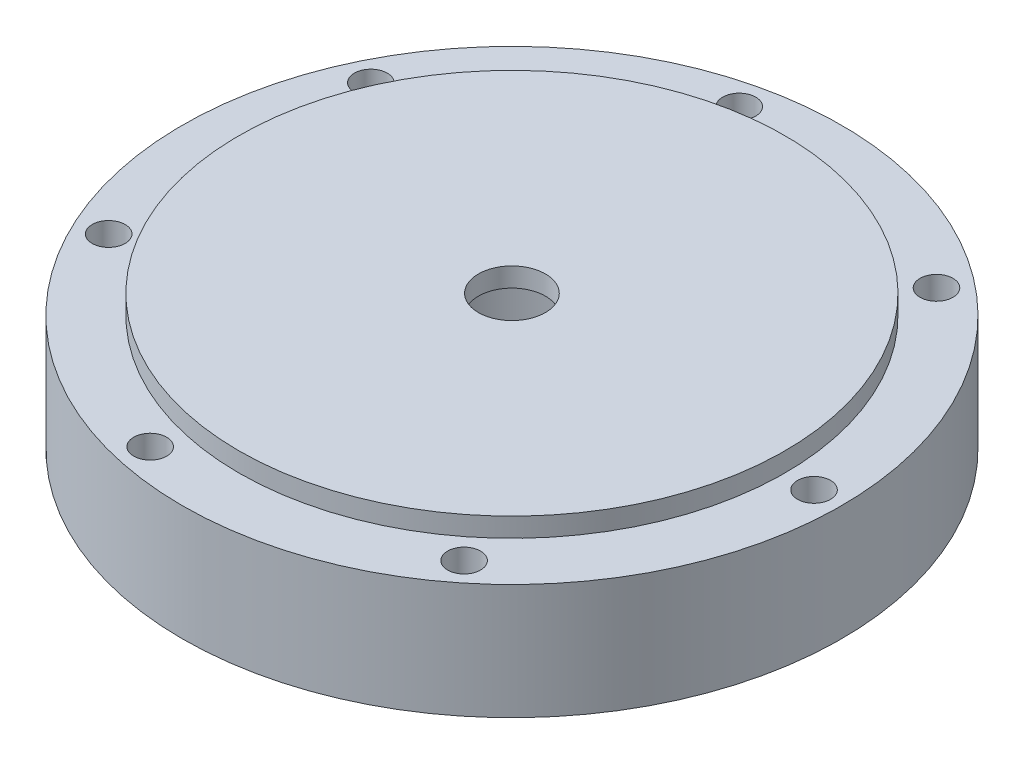
from build123d import *

# Parameters (mm, degrees)
CROQUIS1_R              = 24.85
CROQUIS1_R_2            = 3.05
SALIENTE_EXTRUIR1_DEPTH = 1.75
CROQUIS2_R              = 30
SALIENTE_EXTRUIR2_DEPTH = 10.5
CROQUIS3_R              = 1.5
CORTAR_EXTRUIR1_DEPTH   = 44.706406853


with BuildPart() as part:
    # Croquis1 → Saliente-Extruir1 (new body)
    with BuildSketch(Plane(origin=(0, 0, 0), x_dir=(1, 0, 0), z_dir=(0, 1, 0))):
        with Locations(Location((0, 0, 0), (0, 0, 270))):
            Circle(CROQUIS1_R)
        with Locations(Location((0, 0, 0), (0, 0, 270))):
            Circle(CROQUIS1_R_2, mode=Mode.SUBTRACT)
    extrude(amount=SALIENTE_EXTRUIR1_DEPTH)

    # Croquis2 → Saliente-Extruir2 (add)
    with BuildSketch(Plane(origin=(0, 0, 0), x_dir=(1, 0, 0), z_dir=(0, 1, 0))):
        with Locations(Location((0, 0, 0), (0, 0, 270))):
            Circle(CROQUIS2_R)
        with BuildLine():
            Line((-4.135214626, 9.05), (4.135214626, 9.05))
            ThreePointArc((4.135214626, 9.05), (4.370264873, 9.021983221), (4.592144419, 8.939502762))
            ThreePointArc((4.592144419, 8.939502762), (10.05, 0), (4.592144419, -8.939502762))
            ThreePointArc((4.592144419, -8.939502762), (4.370264873, -9.021983221), (4.135214626, -9.05))
            Line((4.135214626, -9.05), (-4.135214626, -9.05))
            ThreePointArc((-4.135214626, -9.05), (-4.370264873, -9.021983221), (-4.592144419, -8.939502762))
            ThreePointArc((-4.592144419, -8.939502762), (-10.05, 0), (-4.592144419, 8.939502762))
            ThreePointArc((-4.592144419, 8.939502762), (-4.370264873, 9.021983221), (-4.135214626, 9.05))
        make_face(mode=Mode.SUBTRACT)
    extrude(amount=-SALIENTE_EXTRUIR2_DEPTH)

    # Croquis3 → Cortar-Extruir1 (cut, through all)
    with BuildSketch(Plane(origin=(0, 0, 0), x_dir=(1, 0, 0), z_dir=(0, 1, 0))):
        with Locations(Location((27.5, 0, 0), (0, 0, 270))):
            Circle(CROQUIS3_R)
        with Locations(Location((17.145969551, -21.500365768, 0), (0, 0, 270))):
            Circle(CROQUIS3_R)
        with Locations(Location((-6.119325684, -26.810517585, 0), (0, 0, 270))):
            Circle(CROQUIS3_R)
        with Locations(Location((-24.776643867, -11.931802826, 0), (0, 0, 270))):
            Circle(CROQUIS3_R)
        with Locations(Location((-24.776643867, 11.931802826, 0), (0, 0, 270))):
            Circle(CROQUIS3_R)
        with Locations(Location((-6.119325684, 26.810517585, 0), (0, 0, 270))):
            Circle(CROQUIS3_R)
        with Locations(Location((17.145969551, 21.500365768, 0), (0, 0, 270))):
            Circle(CROQUIS3_R)
    extrude(amount=-CORTAR_EXTRUIR1_DEPTH, mode=Mode.SUBTRACT)


solid = part.part
